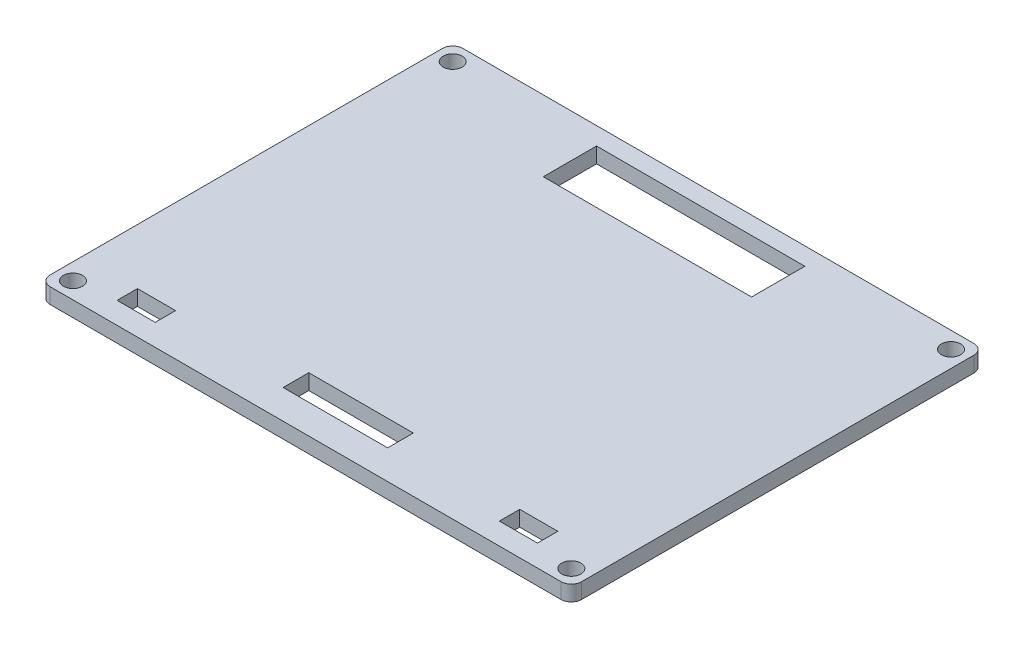
from build123d import *

# Parameters (mm, degrees)
SKETCH_1_R      = 1.85
SKETCH_1_W      = 40.374860346
SKETCH_1_H      = 10.321291022
SKETCH_1_W_2    = 7.387531562
SKETCH_1_H_2    = 3.94976935
SKETCH_1_W_3    = 20.26085389
SKETCH_1_H_3    = 4.973783626
EXTRUDE_1_DEPTH = 3


with BuildPart() as part:
    # 草图1 → 凸台-拉伸1 (new body)
    with BuildSketch(Plane(origin=(0, 0, 0), x_dir=(1, 0, 0), z_dir=(0, 1, 0))):
        with BuildLine():
            Line((49.5, -40), (-49.5, -40))
            ThreePointArc((-49.5, -40), (-50.914213562, -39.414213562), (-51.5, -38))
            Line((-51.5, -38), (-51.5, 38))
            ThreePointArc((-51.5, 38), (-50.914213562, 39.414213562), (-49.5, 40))
            Line((-49.5, 40), (49.5, 40))
            ThreePointArc((49.5, 40), (50.914213562, 39.414213562), (51.5, 38))
            Line((51.5, 38), (51.5, -38))
            ThreePointArc((51.5, -38), (50.914213562, -39.414213562), (49.5, -40))
        make_face()
        with Locations(Location((-48.296806281, 36.796806281, 0), (0, 0, 270))):
            Circle(SKETCH_1_R, mode=Mode.SUBTRACT)
        with Locations(Location((48.296806281, 36.796806281, 0), (0, 0, 270))):
            Circle(SKETCH_1_R, mode=Mode.SUBTRACT)
        with Locations(Location((48.296806281, -36.796806281, 0), (0, 0, 270))):
            Circle(SKETCH_1_R, mode=Mode.SUBTRACT)
        with Locations(Location((-48.296806281, -36.796806281, 0), (0, 0, 270))):
            Circle(SKETCH_1_R, mode=Mode.SUBTRACT)
        with Locations((0, 31.409786363)):
            Rectangle(SKETCH_1_W, SKETCH_1_H, mode=Mode.SUBTRACT)
        with Locations((37.047373629, -33.829043047)):
            Rectangle(SKETCH_1_W_2, SKETCH_1_H_2, mode=Mode.SUBTRACT)
        with Locations((0.109715815, -31.854158372)):
            Rectangle(SKETCH_1_W_3, SKETCH_1_H_3, mode=Mode.SUBTRACT)
        with Locations((-37.047373629, -33.829043047)):
            Rectangle(SKETCH_1_W_2, SKETCH_1_H_2, mode=Mode.SUBTRACT)
    extrude(amount=EXTRUDE_1_DEPTH)


solid = part.part
